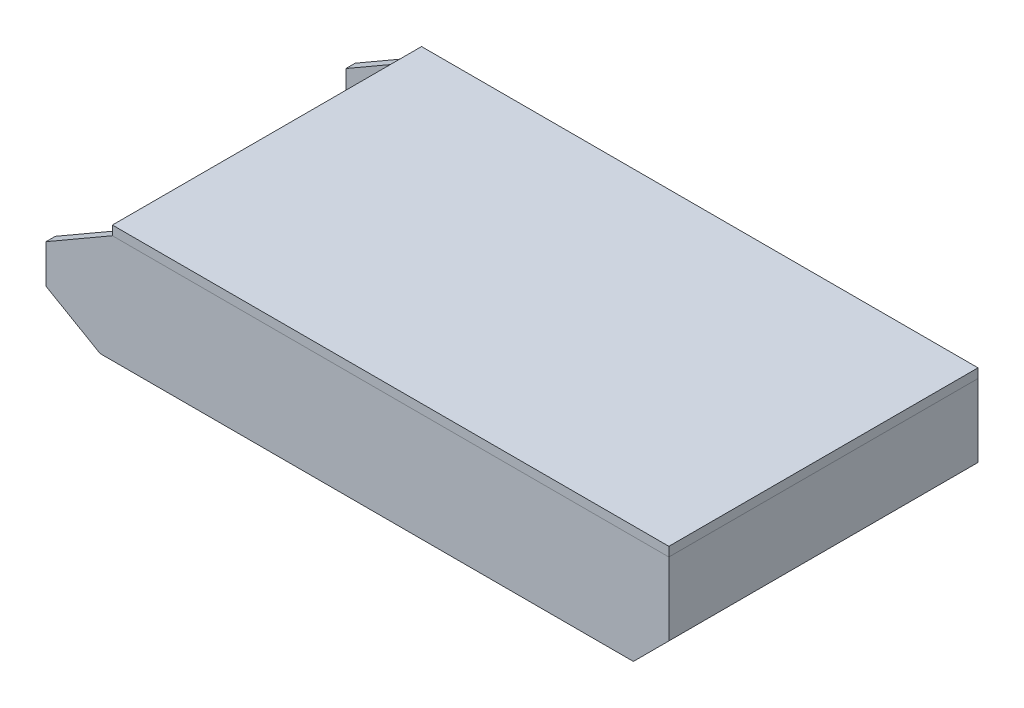
from build123d import *

# Parameters (mm, degrees)
BOSS_EXTRUDE2_DEPTH = 6
BOSS_EXTRUDE3_DEPTH = 6
BOSS_EXTRUDE4_DEPTH = 188
SKETCH13_W          = 6
SKETCH13_H          = 47.042386743
BOSS_EXTRUDE5_DEPTH = 188
BOSS_EXTRUDE6_DEPTH = 188
BOSS_EXTRUDE7_DEPTH = 188
SKETCH16_W          = 360
SKETCH16_H          = 200
BOSS_EXTRUDE8_DEPTH = 6


with BuildPart() as part:
    # Right Panel → Boss-Extrude2 (new body)
    with BuildSketch(Plane(origin=(0, 0, -100), x_dir=(-1, 0, 0), z_dir=(0, 0, -1))):
        Polygon((-180, 70), (180, 70), (222.957613257, 45.198410422), (222.957613257, 20.207259422), (187.957613257, 0), (-157.042386743, 0), (-180, 22.957613257), align=None)
    extrude(amount=-BOSS_EXTRUDE2_DEPTH)



with BuildPart() as body_2:
    # Left Panel(Main) → Boss-Extrude3 (new body)
    with BuildSketch(Plane.XY.offset(100)):
        Polygon((157.042386743, 0), (-187.957613257, 0), (-222.957613257, 20.207259422), (-222.957613257, 45.198410422), (-180, 70), (180, 70), (180, 22.957613257), align=None)
    extrude(amount=-BOSS_EXTRUDE3_DEPTH)


with BuildPart() as body_3:
    # Sketch12 → Boss-Extrude4 (new body)
    with BuildSketch(Plane.XY.offset(-94)):
        Polygon((-110, 8.485281374), (-171.514718626, 70), (-180, 70), (-110, 0), align=None)
    extrude(amount=BOSS_EXTRUDE4_DEPTH)


with BuildPart() as body_4:
    # Sketch13 → Boss-Extrude5 (new body)
    with BuildSketch(Plane.XY.offset(-94)):
        with Locations((177, 46.478806629)):
            Rectangle(SKETCH13_W, SKETCH13_H)
    extrude(amount=BOSS_EXTRUDE5_DEPTH)


with BuildPart() as part_1:
    add(part.part)

    add(body_2.part)  # Boss-Extrude6 merges body 2

    add(body_3.part)  # Boss-Extrude6 merges body 3
    # Sketch15 → Boss-Extrude6 (add)
    with BuildSketch(Plane.XY.offset(-94)):
        Polygon((-110, 0), (157.042386743, 0), (163.042386743, 6), (-110, 6), align=None)
    extrude(amount=BOSS_EXTRUDE6_DEPTH)


    add(body_4.part)  # Boss-Extrude7 merges body 4
    # Sketch14 → Boss-Extrude7 (add)
    with BuildSketch(Plane.XY.offset(-94)):
        Polygon((180, 22.957613257), (163.042386743, 6), (154.557105369, 6), (171.514718626, 22.957613257), align=None)
    extrude(amount=BOSS_EXTRUDE7_DEPTH)


with BuildPart() as body_2_2:
    # Sketch16 → Boss-Extrude8 (new body)
    with BuildSketch(Plane(origin=(0, 70, 0), x_dir=(1, 0, 0), z_dir=(0, 1, 0))):
        Rectangle(SKETCH16_W, SKETCH16_H)
    extrude(amount=BOSS_EXTRUDE8_DEPTH)


solid = Compound([part_1.part, body_2_2.part])
